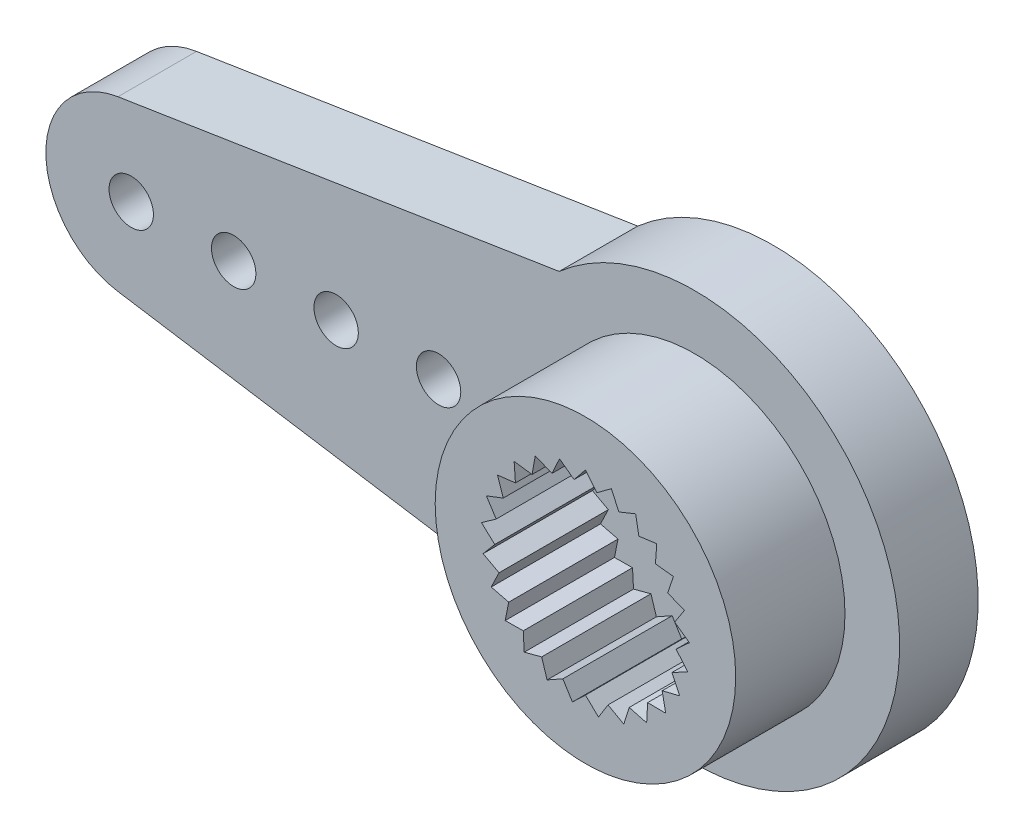
from build123d import *

# Parameters (mm, degrees)
SKETCH_1_R          = 0.65
SKETCH_1_R_2        = 1.5
EXTRUDE_1_DEPTH     = 2.3
SKETCH_2_R          = 4.4
EXTRUDE_2_DEPTH     = 3.2
SKETCH_3_R          = 4.4
SKETCH_3_R_2        = 3.4
SKETCH_3_R_3        = 2.75
SKETCH_3_R_4        = 1.5
CUT_EXTRUDE_1_DEPTH = 1
CUT_EXTRUDE1_REACH  = 22.67


with BuildPart() as part:
    # Эскиз1 → Бобышка-Вытянуть1 (new body)
    with BuildSketch(Plane.XY):
        with BuildLine():
            Line((-3.968626967, 4.5), (-16.888114198, 2.469689731))
            ThreePointArc((-16.888114198, 2.469689731), (-19, 0), (-16.888114198, -2.469689731))
            Line((-16.888114198, -2.469689731), (-3.968626967, -4.5))
            ThreePointArc((-3.968626967, -4.5), (0, -6), (3.968626967, -4.5))
            Line((3.968626967, -4.5), (16.888114198, -2.469689731))
            ThreePointArc((16.888114198, -2.469689731), (19, 0), (16.888114198, 2.469689731))
            Line((16.888114198, 2.469689731), (3.968626967, 4.5))
            ThreePointArc((3.968626967, 4.5), (0, 6), (-3.968626967, 4.5))
        make_face()
        with Locations((-16.5, 0)):
            Circle(SKETCH_1_R, mode=Mode.SUBTRACT)
        with Locations((-13.5, 0)):
            Circle(SKETCH_1_R, mode=Mode.SUBTRACT)
        with Locations((-10.5, 0)):
            Circle(SKETCH_1_R, mode=Mode.SUBTRACT)
        with Locations((-7.5, 0)):
            Circle(SKETCH_1_R, mode=Mode.SUBTRACT)
        with Locations(Location((16.5, 0, 0), (0, 0, 180))):
            Circle(SKETCH_1_R, mode=Mode.SUBTRACT)
        with Locations(Location((7.5, 0, 0), (0, 0, 180))):
            Circle(SKETCH_1_R, mode=Mode.SUBTRACT)
        with Locations(Location((10.5, 0, 0), (0, 0, 180))):
            Circle(SKETCH_1_R, mode=Mode.SUBTRACT)
        with Locations(Location((13.5, 0, 0), (0, 0, 180))):
            Circle(SKETCH_1_R, mode=Mode.SUBTRACT)
        Circle(SKETCH_1_R_2, mode=Mode.SUBTRACT)
    extrude(amount=EXTRUDE_1_DEPTH)

    # Эскиз2 → Бобышка-Вытянуть2 (add)
    with BuildSketch(Plane.XY.offset(2.3)):
        with Locations(Location((0, 0, 0), (0, 0, 180))):
            Circle(SKETCH_2_R)
        Polygon((0.333439775, 2.639447604), (0, 3.05), (-0.333439775, 2.639447604), (-0.758504156, 2.954178641), (-0.979368078, 2.473601404), (-1.469348706, 2.672735374), (-1.563759083, 2.15232973), (-2.087868673, 2.223354314), (-2.049893354, 1.695819264), (-2.575200173, 1.634271725), (-2.407225286, 1.132754236), (-2.900722375, 0.942501833), (-2.6133024, 0.498514094), (-3.043981522, 0.191511085), (-2.655176114, -0.167049522), (-2.995976115, -0.571513009), (-2.530215347, -0.822116802), (-2.75972251, -1.298626839), (-2.246271844, -1.42552746), (-2.35006539, -1.944143169), (-1.821186821, -1.939366985), (-1.792745019, -2.467501833), (-1.281669931, -2.33134895), (-1.122779886, -2.835818282), (-0.661621006, -2.576843686), (-0.382266362, -3.025949839), (0, -2.660425857), (0.382266362, -3.025949839), (0.661621006, -2.576843686), (1.122779886, -2.835818282), (1.281669931, -2.33134895), (1.792745019, -2.467501833), (1.821186821, -1.939366985), (2.35006539, -1.944143169), (2.246271844, -1.42552746), (2.75972251, -1.298626839), (2.530215347, -0.822116802), (2.995976115, -0.571513009), (2.655176114, -0.167049522), (3.043981522, 0.191511085), (2.6133024, 0.498514094), (2.900722375, 0.942501833), (2.407225286, 1.132754236), (2.575200173, 1.634271725), (2.049893354, 1.695819264), (2.087868673, 2.223354314), (1.563759083, 2.15232973), (1.469348706, 2.672735374), (0.979368078, 2.473601404), (0.758504156, 2.954178641), align=None, mode=Mode.SUBTRACT)
    extrude(amount=EXTRUDE_2_DEPTH)

    # Эскиз3 → Вырез-Вытянуть1 (cut)
    # profile 1 of 2: a face of its own
    with BuildSketch(Plane(origin=(0, 0, 0), x_dir=(-1, 0, 0), z_dir=(0, 0, -1))):
        Circle(SKETCH_3_R)
        Circle(SKETCH_3_R_2, mode=Mode.SUBTRACT)
    # profile 2 of 2: a face of its own
    with BuildSketch(Plane(origin=(0, 0, 0), x_dir=(-1, 0, 0), z_dir=(0, 0, -1))):
        Circle(SKETCH_3_R_3)
        Circle(SKETCH_3_R_4, mode=Mode.SUBTRACT)
    extrude(amount=-CUT_EXTRUDE_1_DEPTH, mode=Mode.SUBTRACT)

    # Sketch1 → Cut-Extrude1 (cut, up to next)
    with BuildSketch(Plane(origin=(0, 0, 0), x_dir=(-1, 0, 0), z_dir=(0, 0, -1)), mode=Mode.PRIVATE) as cut_extrude1_sk1:
        with BuildLine():
            Line((-3.968626967, 4.5), (-16.888114198, 2.469689731))
            ThreePointArc((-16.888114198, 2.469689731), (-19, 0), (-16.888114198, -2.469689731))
            Line((-16.888114198, -2.469689731), (-3.968626967, -4.5))
            ThreePointArc((-3.968626967, -4.5), (-6, 0), (-3.968626967, 4.5))
        make_face()
    cut_extrude1_tool1 = extrude(cut_extrude1_sk1.sketch, amount=-CUT_EXTRUDE1_REACH, mode=Mode.PRIVATE) & part.part
    add(cut_extrude1_tool1.solids().sort_by_distance((11.282562, 0, 0))[0], mode=Mode.SUBTRACT)


solid = part.part
